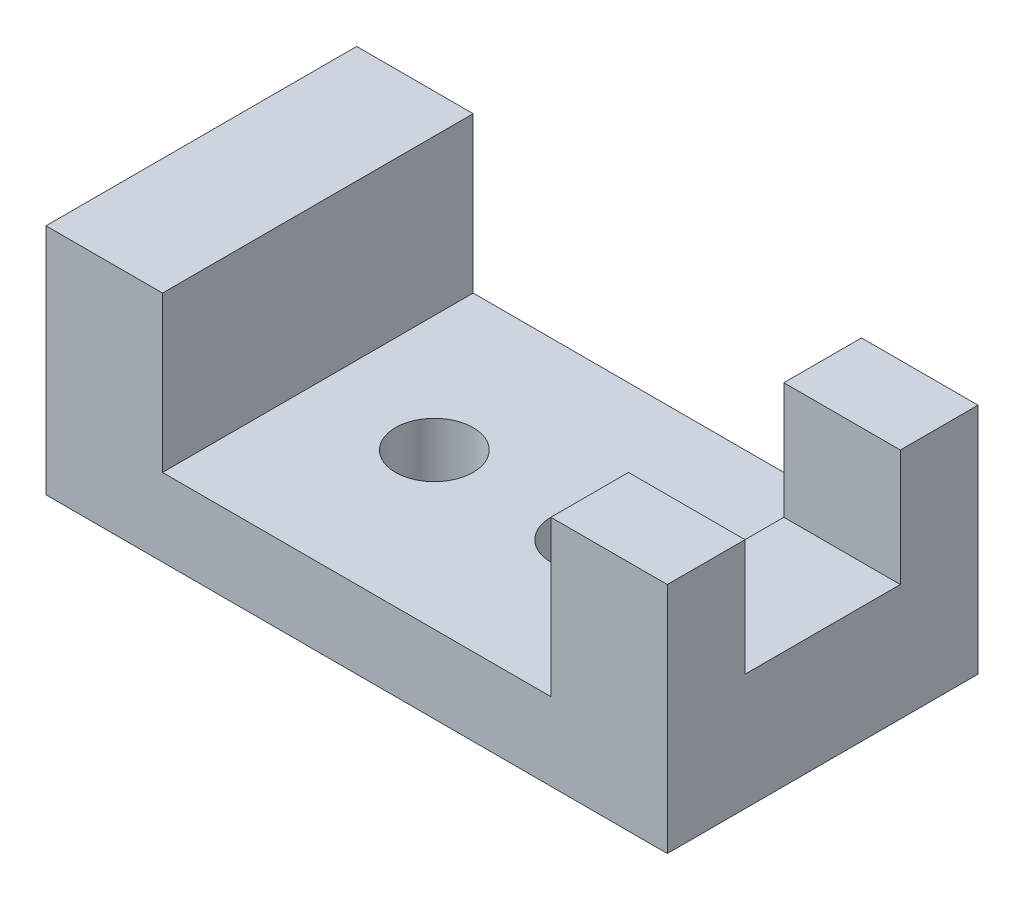
from build123d import *

# Parameters (mm, degrees)
SKETCH_1_W        = 15
SKETCH_1_H        = 40
EXTRUDE_2_DEPTH   = 30
SKETCH_1_H_2      = 10
EXTRUDE_2_2_DEPTH = 30
EXTRUDE_2_3_DEPTH = 30
SKETCH_1_6_W      = 15
SKETCH_1_6_H      = 20
EXTRUDE_4_DEPTH   = 15
SKETCH_1_7_R      = 5
EXTRUDE_5_DEPTH   = 10


with BuildPart() as part:
    # 스케치1 → 보스-돌출2 (new body)
    with BuildSketch(Plane(origin=(0, 0, 0), x_dir=(1, 0, 0), z_dir=(0, 1, 0))):
        with Locations((-43.568318821, -33.556262559)):
            Rectangle(SKETCH_1_W, SKETCH_1_H)
    extrude(amount=EXTRUDE_2_DEPTH)



with BuildPart() as body_2:
    # 스케치1 → Extrude 2 2 (new body)
    with BuildSketch(Plane(origin=(0, 0, 0), x_dir=(1, 0, 0), z_dir=(0, 1, 0))):
        with Locations((21.431681179, -18.556262559)):
            Rectangle(SKETCH_1_W, SKETCH_1_H_2)
    extrude(amount=EXTRUDE_2_2_DEPTH)



with BuildPart() as body_3:
    # 스케치1 → Extrude 2 3 (new body)
    with BuildSketch(Plane(origin=(0, 0, 0), x_dir=(1, 0, 0), z_dir=(0, 1, 0))):
        with Locations((21.431681179, -48.556262559)):
            Rectangle(SKETCH_1_W, SKETCH_1_H_2)
    extrude(amount=EXTRUDE_2_3_DEPTH)


with BuildPart() as body_2_1:
    add(body_2.part)

    add(body_3.part)  # 보스-돌출4 merges body 3
    # 스케치1<6> → 보스-돌출4 (add)
    with BuildSketch(Plane(origin=(0, 0, 0), x_dir=(1, 0, 0), z_dir=(0, 1, 0))):
        with Locations((21.431681179, -33.556262559)):
            Rectangle(SKETCH_1_6_W, SKETCH_1_6_H)
    extrude(amount=EXTRUDE_4_DEPTH)


with BuildPart() as part_1:
    add(part.part)

    add(body_2_1.part)  # 보스-돌출5 merges body 2
    # 스케치1<7> → 보스-돌출5 (add)
    with BuildSketch(Plane(origin=(0, 0, 0), x_dir=(1, 0, 0), z_dir=(0, 1, 0))):
        Polygon((13.931681179, -13.556262559), (-36.068318821, -13.556262559), (-36.068318821, -53.556262559), (13.931681179, -53.556262559), (13.931681179, -43.556262559), (13.931681179, -23.556262559), align=None)
        with Locations((-21.068318821, -33.556262559)):
            Circle(SKETCH_1_7_R, mode=Mode.SUBTRACT)
        with Locations((-1.068318821, -33.556262559)):
            Circle(SKETCH_1_7_R, mode=Mode.SUBTRACT)
    extrude(amount=EXTRUDE_5_DEPTH)


solid = part_1.part
